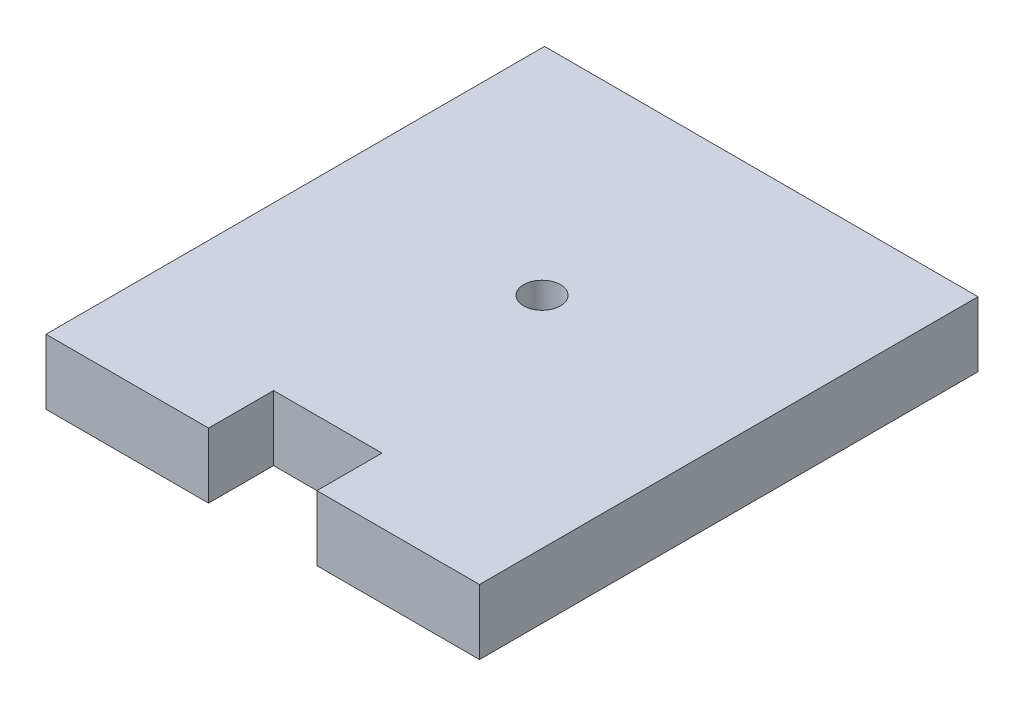
from build123d import *

# Parameters (mm, degrees)
SKETCH1_W           = 20
SKETCH1_H           = 23
SKETCH1_R           = 0.85
BOSS_EXTRUDE1_DEPTH = 3
SKETCH3_W           = 5
SKETCH3_H           = 3
CUT_EXTRUDE1_DEPTH  = 31.626785662


with BuildPart() as part:
    # Sketch1 → Boss-Extrude1 (new body)
    with BuildSketch(Plane(origin=(0, 0, 0), x_dir=(1, 0, 0), z_dir=(0, 1, 0))):
        with Locations((10, -11.5)):
            Rectangle(SKETCH1_W, SKETCH1_H)
        with Locations(Location((9.886762672, -9.999358845, 0), (0, 0, 270))):
            Circle(SKETCH1_R, mode=Mode.SUBTRACT)
    extrude(amount=BOSS_EXTRUDE1_DEPTH)

    # Sketch3 → Cut-Extrude1 (cut, through all)
    with BuildSketch(Plane(origin=(0, 3, 0), x_dir=(1, 0, 0), z_dir=(0, 1, 0))):
        with Locations((10, -21.5)):
            Rectangle(SKETCH3_W, SKETCH3_H)
    extrude(amount=-CUT_EXTRUDE1_DEPTH, mode=Mode.SUBTRACT)


solid = part.part
